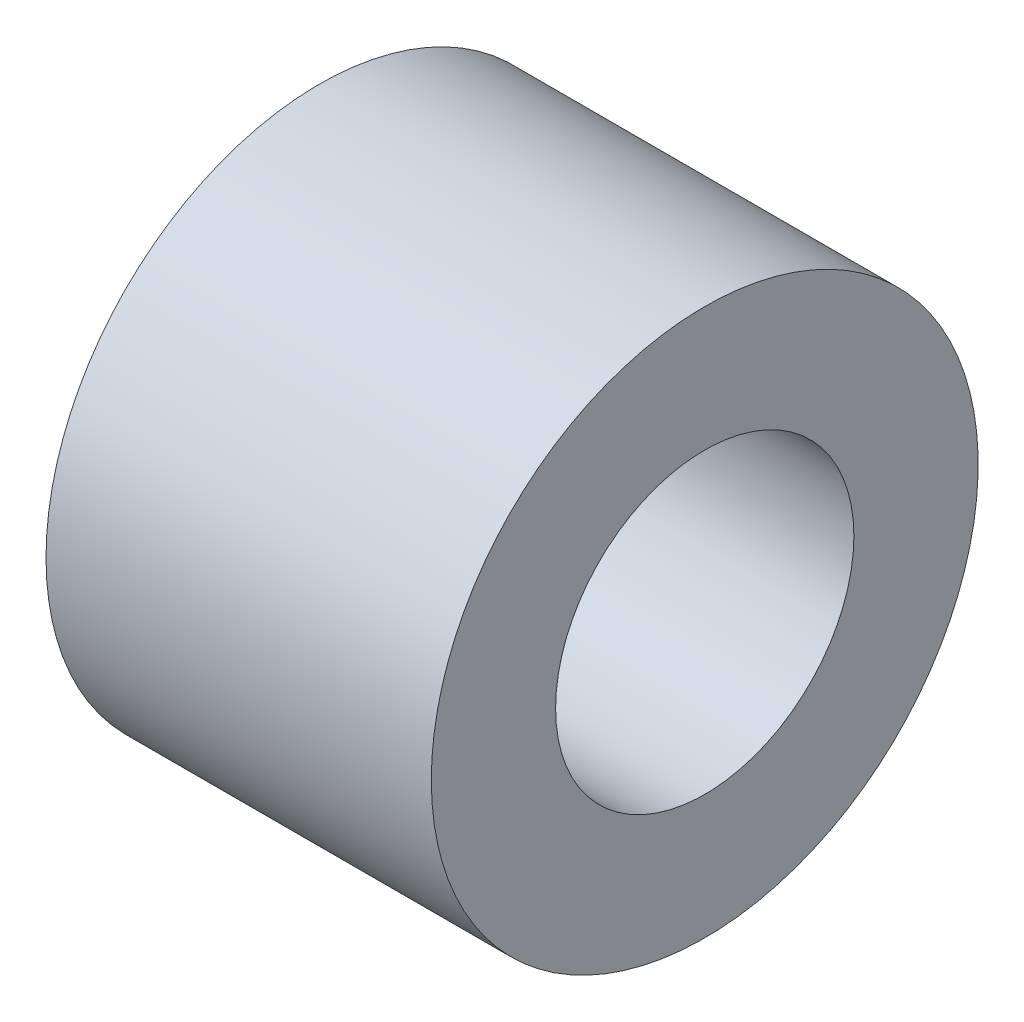
from build123d import *

# Parameters (mm, degrees)
SKIZZE2_W = 15.5
SKIZZE2_H = 5


with BuildPart() as part:
    # Skizze2 → Rotation1 (revolve)
    with BuildSketch(Plane(origin=(0, 0, 0), x_dir=(1, 0, 0), z_dir=(0, 1, 0)), mode=Mode.PRIVATE) as rotation1_sk:
        with Locations((7.75, 8.5)):
            Rectangle(SKIZZE2_W, SKIZZE2_H)
        with Locations((7.75, -8.5)):
            Rectangle(SKIZZE2_W, SKIZZE2_H)
    revolve(rotation1_sk.sketch.rotate(Axis((0, 0, 0), (1, 0, 0)), 180), axis=Axis((0, 0, 0), (1, 0, 0)))


solid = part.part
